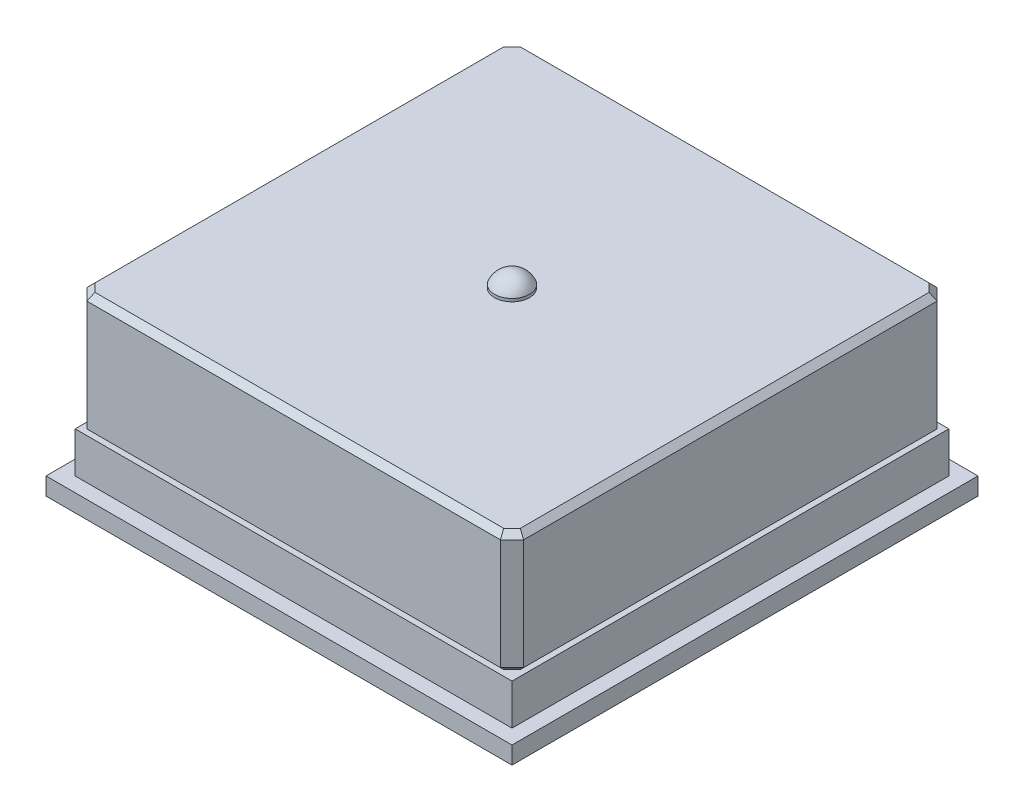
from build123d import *

# Parameters (mm, degrees)
SKETCH1_W           = 16
SKETCH1_H           = 16
BOSS_EXTRUDE1_DEPTH = 0.6
SKETCH2_W           = 15
SKETCH2_H           = 15
BOSS_EXTRUDE2_DEPTH = 1.4
BOSS_EXTRUDE3_DEPTH = 4.2
CHAMFER1_SIZE       = 0.2
SKETCH4_R           = 0.6
BOSS_EXTRUDE4_DEPTH = 0.1
DOME1_FACE_RADIUS   = 0.6
DOME1_HEIGHT        = 0.4


with BuildPart() as part:
    # Sketch1 → Boss-Extrude1 (new body)
    with BuildSketch(Plane(origin=(0, 0, 0), x_dir=(1, 0, 0), z_dir=(0, 1, 0))):
        Rectangle(SKETCH1_W, SKETCH1_H)
    extrude(amount=BOSS_EXTRUDE1_DEPTH)

    # Sketch2 → Boss-Extrude2 (add)
    with BuildSketch(Plane(origin=(0, 0.6, 0), x_dir=(1, 0, 0), z_dir=(0, 1, 0))):
        Rectangle(SKETCH2_W, SKETCH2_H)
    extrude(amount=BOSS_EXTRUDE2_DEPTH)


with BuildPart() as body_2:
    # Sketch3 → Boss-Extrude3 (new body)
    with BuildSketch(Plane(origin=(0, 2, 0), x_dir=(1, 0, 0), z_dir=(0, 1, 0))):
        Polygon((-7.1, 7.5), (-7.5, 7.1), (-7.5, -7.1), (-7.1, -7.5), (7.1, -7.5), (7.5, -7.1), (7.5, 7.1), (7.1, 7.5), align=None)
    extrude(amount=BOSS_EXTRUDE3_DEPTH)

    # Chamfer1
    chamfer1_edges = [body_2.edges().sort_by_distance(p)[0] for p in [
        (0, 6.2, 7.5),
        (-7.3, 2, 7.3),
        (-7.5, 2, 0),
        (7.3, 6.2, 7.3),
        (7.5, 6.2, 0),
        (7.3, 6.2, -7.3),
        (0, 6.2, -7.5),
        (-7.3, 6.2, -7.3),
        (-7.5, 6.2, 0),
        (-7.3, 6.2, 7.3),
        (-7.3, 2, -7.3),
        (0, 2, -7.5),
        (7.3, 2, -7.3),
        (7.5, 2, 0),
        (7.3, 2, 7.3),
        (0, 2, 7.5),
    ]]
    chamfer(chamfer1_edges, length=CHAMFER1_SIZE)

    # Combine1: union part
    add(part.part)

    # Sketch4 → Boss-Extrude4 (add)
    with BuildSketch(Plane(origin=(0, 6.2, 0), x_dir=(1, 0, 0), z_dir=(0, 1, 0))):
        with Locations(Location((0, 0, 0), (0, 0, 270))):
            Circle(SKETCH4_R)
    extrude(amount=BOSS_EXTRUDE4_DEPTH)

    # Dome1: a dome of height H over a round flat face of radius A is a cap of a sphere of radius (A * A + H * H) / (2 * H)
    dome1_r = (DOME1_FACE_RADIUS * DOME1_FACE_RADIUS + DOME1_HEIGHT * DOME1_HEIGHT) / (2 * DOME1_HEIGHT)
    dome1_base = Plane((0, 6.3, 0), z_dir=(0, 1, 0))
    with Locations(dome1_base.offset(DOME1_HEIGHT - dome1_r)):
        dome1_ball = Sphere(dome1_r, mode=Mode.PRIVATE)
    add(split(dome1_ball, bisect_by=dome1_base, keep=Keep.TOP, mode=Mode.PRIVATE))


solid = body_2.part
